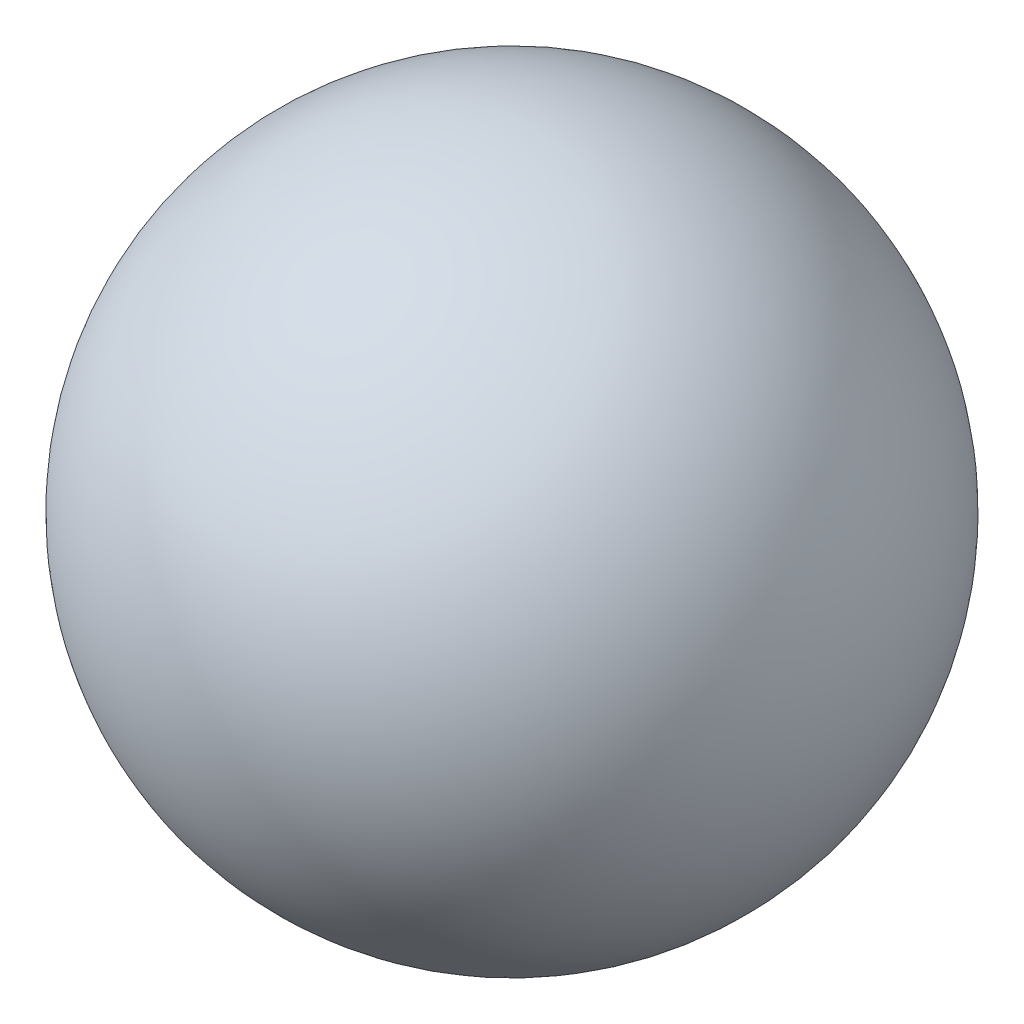
from build123d import *


with BuildPart() as part:
    # Sketch1 → Revolve1 (revolve)
    with BuildSketch(Plane(origin=(0, 0, 0), x_dir=(1, 0, 0), z_dir=(0, 1, 0))):
        with BuildLine():
            Line((0, 0), (0, 20.32))
            ThreePointArc((0, 20.32), (20.32, 0), (0, -20.32))
            Line((0, -20.32), (0, 0))
        make_face()
    revolve(axis=Axis((0, 0, 0), (0, 0, 1)))


solid = part.part
